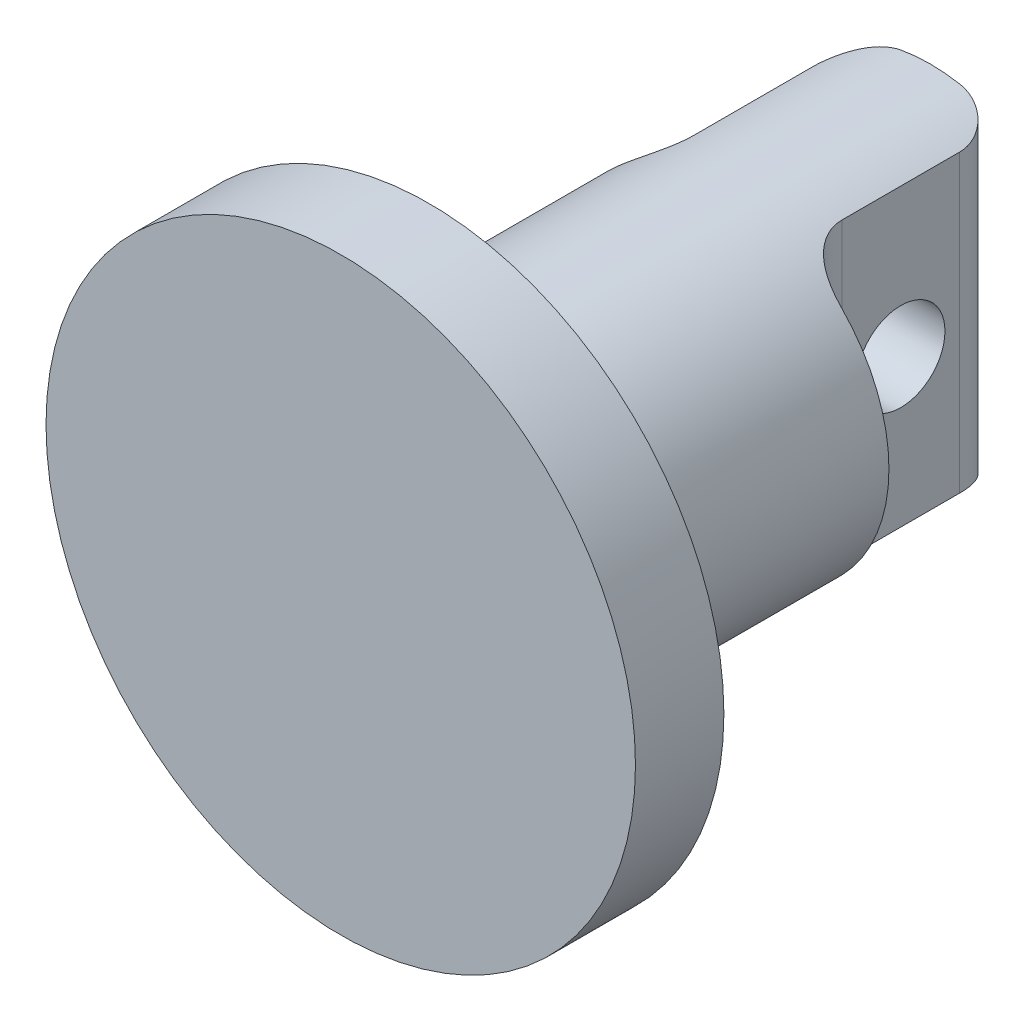
from build123d import *
from OCP.BRepFilletAPI import BRepFilletAPI_MakeFillet

# Parameters (mm, degrees)
SKETCH1_R           = 10
BOSS_EXTRUDE1_DEPTH = 3
SKETCH2_R           = 5.6
BOSS_EXTRUDE2_DEPTH = 17
CUT_EXTRUDE1_DEPTH  = 7
CUT_EXTRUDE2_REACH  = 25.351
SKETCH4_R           = 1.5
FILLET1_R1          = 3
FILLET1_R2          = 1.5


with BuildPart() as part:
    # Sketch1 → Boss-Extrude1 (new body)
    with BuildSketch(Plane.XY):
        Circle(SKETCH1_R)
    extrude(amount=BOSS_EXTRUDE1_DEPTH)

    # Sketch2 → Boss-Extrude2 (add)
    with BuildSketch(Plane(origin=(0, 0, 0), x_dir=(-1, 0, 0), z_dir=(0, 0, -1))):
        Circle(SKETCH2_R)
    extrude(amount=BOSS_EXTRUDE2_DEPTH)

    # Sketch3 → Cut-Extrude1 (cut)
    with BuildSketch(Plane(origin=(0, 0, -17), x_dir=(-1, 0, 0), z_dir=(0, 0, -1))):
        with BuildLine():
            Line((2.5, 0), (2.5, 6.663171691))
            ThreePointArc((2.5, 6.663171691), (8.066213365, -0.537352556), (2.5, -7.737876802))
            Line((2.5, -7.737876802), (2.5, 0))
        make_face()
        with BuildLine():
            Line((-2.5, 0), (-2.5, 6.663171691))
            ThreePointArc((-2.5, 6.663171691), (-7.668145551, -0.537352556), (-2.5, -7.737876802))
            Line((-2.5, -7.737876802), (-2.5, 0))
        make_face()
    extrude(amount=-CUT_EXTRUDE1_DEPTH, mode=Mode.SUBTRACT)

    # Sketch4 → Cut-Extrude2 (cut, up to next)
    with BuildSketch(Plane(origin=(2.5, 0, 0), x_dir=(0, 0, -1), z_dir=(1, 0, 0)), mode=Mode.PRIVATE) as cut_extrude2_sk1:
        with Locations((13.5, 0)):
            Circle(SKETCH4_R)
    cut_extrude2_tool1 = extrude(cut_extrude2_sk1.sketch, amount=-CUT_EXTRUDE2_REACH, mode=Mode.PRIVATE) & part.part
    add(cut_extrude2_tool1.solids().sort_by_distance((2.5, 0, -13.5))[0], mode=Mode.SUBTRACT)

    # Fillet1: one fillet with a radius per group of edges: ONE call of the kernel's fillet builder (fillet() takes one radius for all edges)
    fillet1_edges_1 = [part.edges().sort_by_distance(p)[0] for p in [
        (5.6, 0, 0),
    ]]
    fillet1_edges_2 = [part.edges().sort_by_distance(p)[0] for p in [
        (2.5, 0, -10),
        (-2.5, 0, -10),
        (2.5, 0, -17),
        (-2.5, 0, -17),
    ]]
    fillet1 = BRepFilletAPI_MakeFillet(part.part.solid().wrapped)
    for e in fillet1_edges_1:
        fillet1.Add(FILLET1_R1, e.wrapped)
    for e in fillet1_edges_2:
        fillet1.Add(FILLET1_R2, e.wrapped)
    add(Compound.cast(fillet1.Shape()), mode=Mode.REPLACE)


solid = part.part
